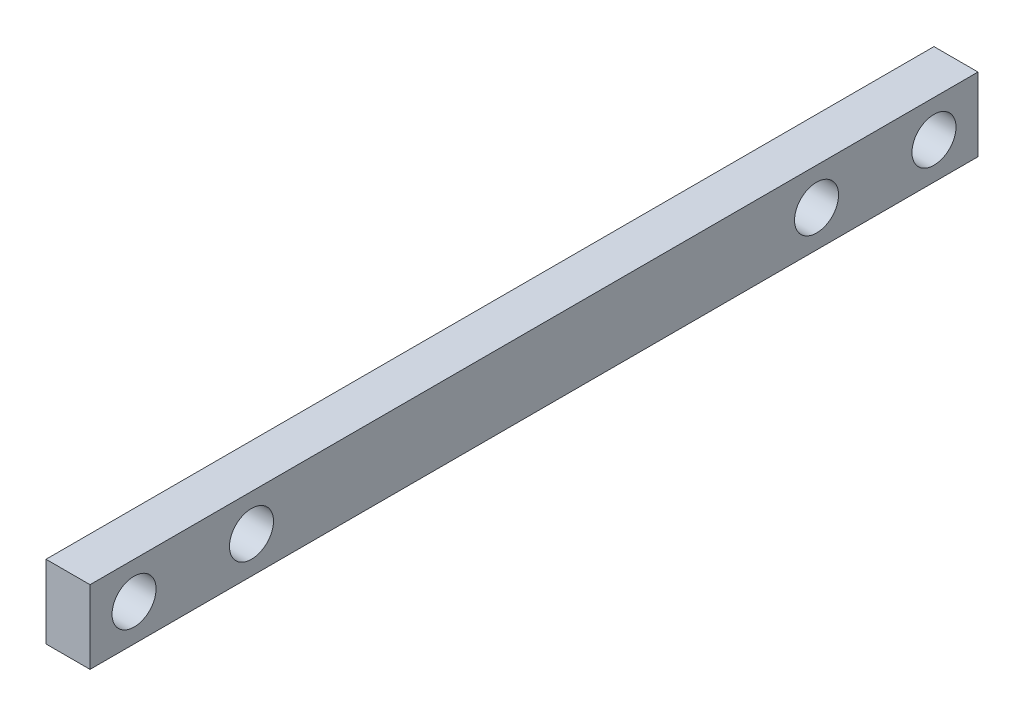
from build123d import *

# Parameters (mm, degrees)
SKETCH1_W           = 60.5
SKETCH1_H           = 5
SKETCH1_R           = 1.5
BOSS_EXTRUDE1_DEPTH = 3


with BuildPart() as part:
    # Sketch1 → Boss-Extrude1 (new body)
    with BuildSketch(Plane(origin=(0, 0, 0), x_dir=(0, 0, -1), z_dir=(1, 0, 0))):
        Rectangle(SKETCH1_W, SKETCH1_H)
        with Locations((-27.25, 0)):
            Circle(SKETCH1_R, mode=Mode.SUBTRACT)
        with Locations((-19.25, 0)):
            Circle(SKETCH1_R, mode=Mode.SUBTRACT)
        with Locations((27.25, 0)):
            Circle(SKETCH1_R, mode=Mode.SUBTRACT)
        with Locations((19.25, 0)):
            Circle(SKETCH1_R, mode=Mode.SUBTRACT)
    extrude(amount=BOSS_EXTRUDE1_DEPTH)


solid = part.part
